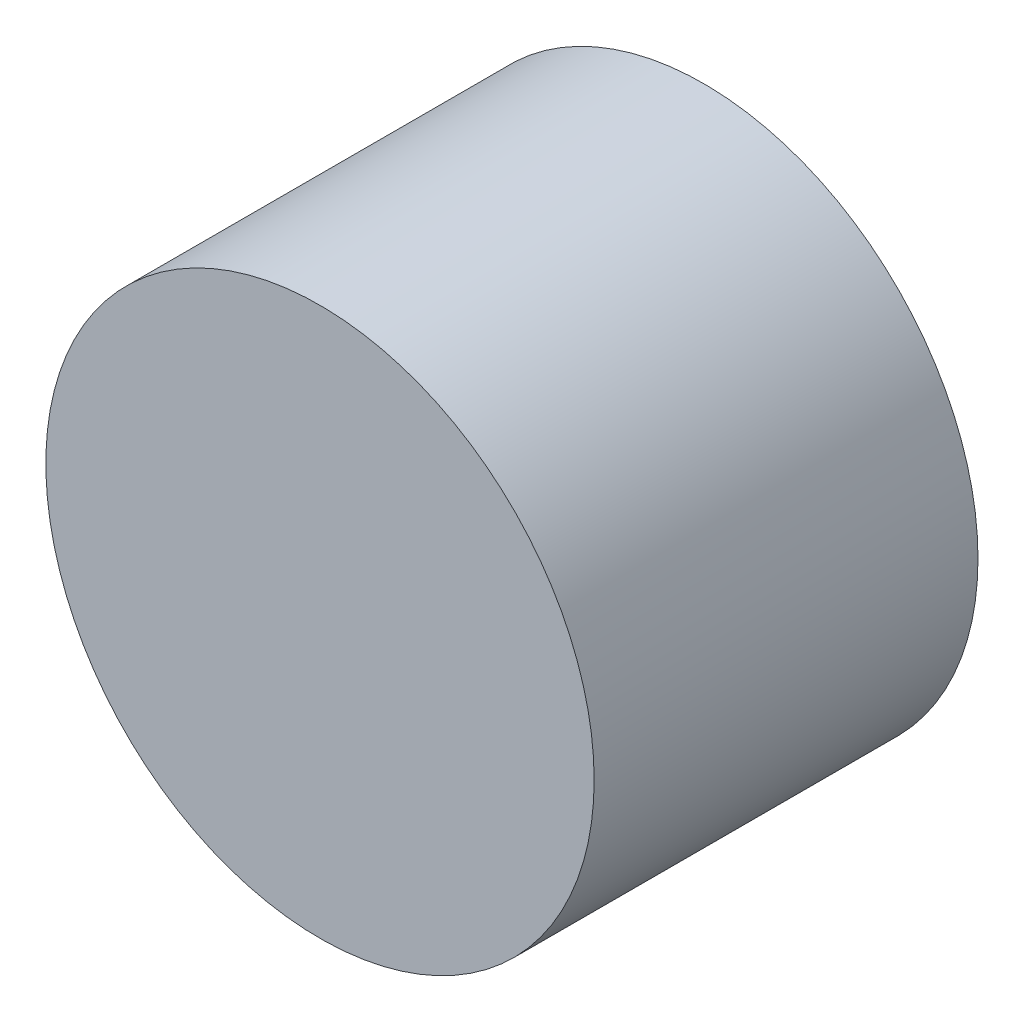
from build123d import *

# Parameters (mm, degrees)
SKETCH_1_R      = 20
EXTRUDE_1_DEPTH = 28


with BuildPart() as part:
    # 草图1 → 凸台-拉伸1 (new body)
    with BuildSketch(Plane.XY):
        Circle(SKETCH_1_R)
    extrude(amount=EXTRUDE_1_DEPTH)


solid = part.part
